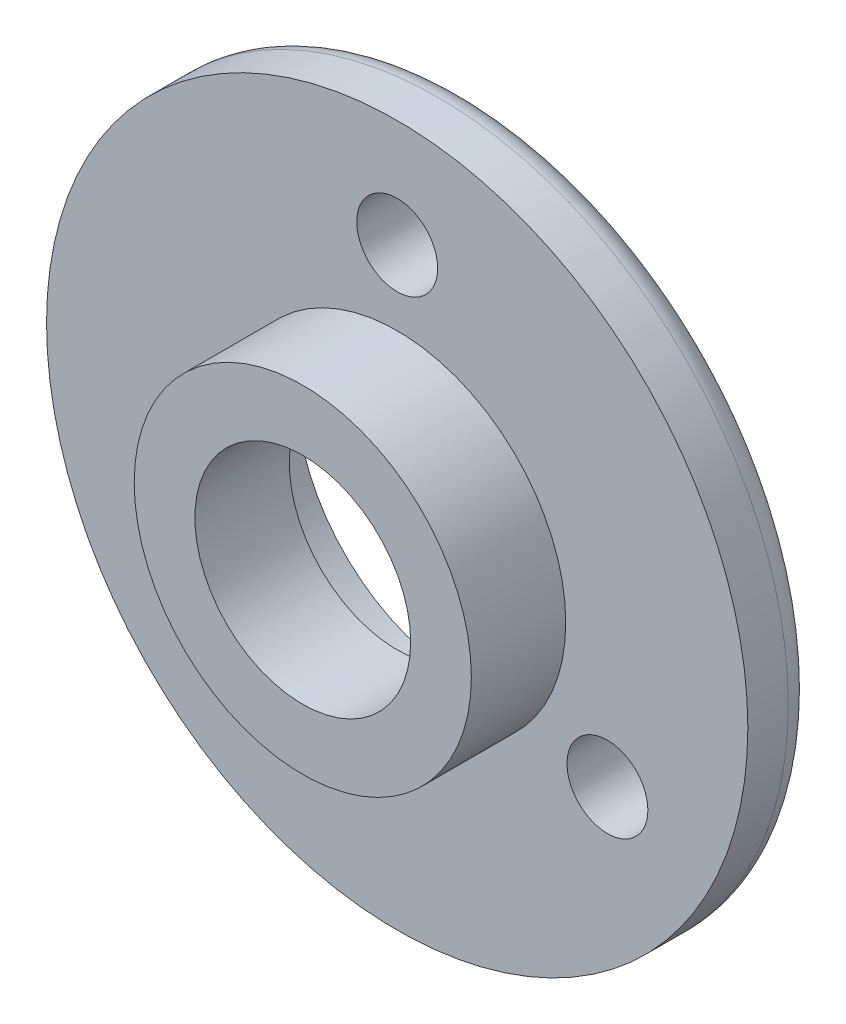
from build123d import *

# Parameters (mm, degrees)
SKETCH1_R           = 26
BOSS_EXTRUDE1_DEPTH = 5
SKETCH2_R           = 12.5
BOSS_EXTRUDE2_DEPTH = 7
SKETCH3_R           = 8
CUT_EXTRUDE1_DEPTH  = 39.678159212
SKETCH4_R           = 3
SKETCH4_R_2         = 12.5
CUT_EXTRUDE2_DEPTH  = 38.429934544
FILLET3_R           = 2


with BuildPart() as part:
    # Sketch1 → Boss-Extrude1 (new body)
    with BuildSketch(Plane.XY):
        Circle(SKETCH1_R)
    extrude(amount=BOSS_EXTRUDE1_DEPTH)

    # Sketch2 → Boss-Extrude2 (add)
    with BuildSketch(Plane.XY.offset(5)):
        Circle(SKETCH2_R)
    extrude(amount=BOSS_EXTRUDE2_DEPTH)

    # Sketch3 → Cut-Extrude1 (cut, through all)
    with BuildSketch(Plane.XY.offset(12)):
        Circle(SKETCH3_R)
    extrude(amount=-CUT_EXTRUDE1_DEPTH, mode=Mode.SUBTRACT)

    # Sketch4 → Cut-Extrude2 (cut, through all)
    with BuildSketch(Plane.XY.offset(5)):
        with Locations((0, 18)):
            Circle(SKETCH4_R)
        with Locations((15.588457268, -9)):
            Circle(SKETCH4_R)
        with Locations((-15.588457268, -9)):
            Circle(SKETCH4_R)
        Circle(SKETCH4_R_2)
    extrude(amount=-CUT_EXTRUDE2_DEPTH, mode=Mode.SUBTRACT)


with BuildPart() as cut_extrude2_piece_1:
    # of the separate pieces the step leaves, piece 1, a body of its own (cut_extrude2_pieces)
    add(part.part.solids().sort_by_distance((26, 0, 0))[0])

    # Fillet3
    fillet3_edges = [cut_extrude2_piece_1.edges().sort_by_distance(p)[0] for p in [
        (-26, 0, 0),
    ]]
    fillet(fillet3_edges, radius=FILLET3_R)


with BuildPart() as cut_extrude2_piece_2:
    # of the separate pieces the step leaves, piece 2, a body of its own (cut_extrude2_pieces)
    add(part.part.solids().sort_by_distance((12.5, 0, 12))[0])


solid = Compound([cut_extrude2_piece_1.part, cut_extrude2_piece_2.part])
